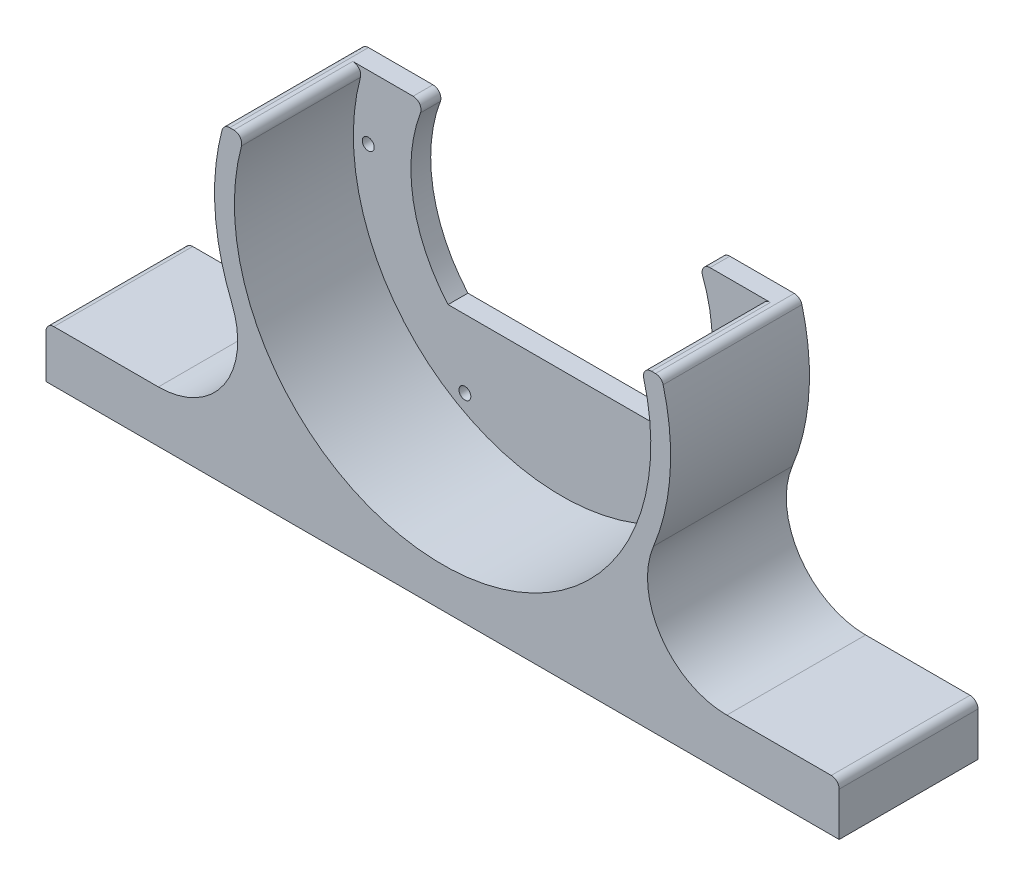
from build123d import *

# Parameters (mm, degrees)
SKETCH2_R           = 1.5
BOSS_EXTRUDE1_DEPTH = 5
BOSS_EXTRUDE2_DEPTH = 35
FILLET1_R           = 2
SKETCH5_W           = 200
SKETCH5_H           = 5
BOSS_EXTRUDE3_DEPTH = 35
FILLET2_R           = 20
FILLET3_R           = 2


with BuildPart() as part:
    # Sketch2 → Boss-Extrude1 (new body)
    # profile 1 of 2: a face of its own
    with BuildSketch(Plane.XY):
        with BuildLine():
            Line((-34.420778608, 16.1), (-49.970391233, 16.1))
            ThreePointArc((-49.970391233, 16.1), (-8.148756355, -51.863742343), (52.5, 0))
            ThreePointArc((52.5, 0), (51.863742343, 8.148756355), (49.970391233, 16.1))
            Line((49.970391233, 16.1), (34.420778608, 16.1))
            ThreePointArc((34.420778608, 16.1), (37.094403804, 8.246526932), (38, 0))
            ThreePointArc((38, 0), (35.577315031, -13.35120426), (28.618176043, -25))
            ThreePointArc((28.618176043, -25), (0, -38), (-28.618176043, -25))
            ThreePointArc((-28.618176043, -25), (-37.626851461, -5.312254619), (-34.420778608, 16.1))
        make_face()
        with Locations((-24.375, -42.218738434)):
            Circle(SKETCH2_R, mode=Mode.SUBTRACT)
        with Locations((-48.75, 0)):
            Circle(SKETCH2_R, mode=Mode.SUBTRACT)
        with Locations((24.375, -42.218738434)):
            Circle(SKETCH2_R, mode=Mode.SUBTRACT)
        with Locations((48.75, 0)):
            Circle(SKETCH2_R, mode=Mode.SUBTRACT)
    # profile 2 of 2: a face of its own
    with BuildSketch(Plane.XY):
        with BuildLine():
            Line((28.618176043, -25), (-28.618176043, -25))
            ThreePointArc((-28.618176043, -25), (0, -38), (28.618176043, -25))
        make_face()
    extrude(amount=BOSS_EXTRUDE1_DEPTH)

    # Sketch4 → Boss-Extrude2 (add)
    with BuildSketch(Plane.XY):
        with BuildLine():
            ThreePointArc((49.970391233, 16.1), (0, -52.5), (-49.970391233, 16.1))
            Line((-49.970391233, 16.1), (-55.2, 16.1))
            ThreePointArc((-55.2, 16.1), (0, -57.5), (55.2, 16.1))
            Line((55.2, 16.1), (49.970391233, 16.1))
        make_face()
    extrude(amount=BOSS_EXTRUDE2_DEPTH)

    # Fillet1
    fillet1_edges = [part.edges().sort_by_distance(p)[0] for p in [
        (34.420778608, 16.1, 2.5),
        (-34.420778608, 16.1, 2.5),
        (-49.970391233, 16.1, 20),
        (-55.2, 16.1, 17.5),
        (55.2, 16.1, 17.5),
        (49.970391233, 16.1, 20),
    ]]
    fillet(fillet1_edges, radius=FILLET1_R)

    # Sketch5 → Boss-Extrude3 (add)
    with BuildSketch(Plane.XY):
        with BuildLine():
            Line((-100, -57.5), (3.75e-07, -57.5))
            ThreePointArc((3.75e-07, -57.5), (-15.165750707, -55.463952307), (-29.257477677, -49.5))
            Line((-29.257477677, -49.5), (-100, -49.5))
            Line((-100, -49.5), (-100, -57.5))
        make_face()
        with BuildLine():
            Line((3.75e-07, -57.5), (100, -57.5))
            Line((100, -57.5), (100, -49.5))
            Line((100, -49.5), (29.257477677, -49.5))
            ThreePointArc((29.257477677, -49.5), (15.165751069, -55.463952208), (3.75e-07, -57.5))
        make_face()
        with Locations((0, -60)):
            Rectangle(SKETCH5_W, SKETCH5_H)
    extrude(amount=BOSS_EXTRUDE3_DEPTH)

    # Fillet2
    fillet2_edges = [part.edges().sort_by_distance(p)[0] for p in [
        (-29.257477677, -49.5, 17.5),
        (29.257477677, -49.5, 17.5),
    ]]
    fillet(fillet2_edges, radius=FILLET2_R)

    # Fillet3
    fillet3_edges = [part.edges().sort_by_distance(p)[0] for p in [
        (100, -49.5, 17.5),
        (-100, -49.5, 17.5),
    ]]
    fillet(fillet3_edges, radius=FILLET3_R)


solid = part.part
